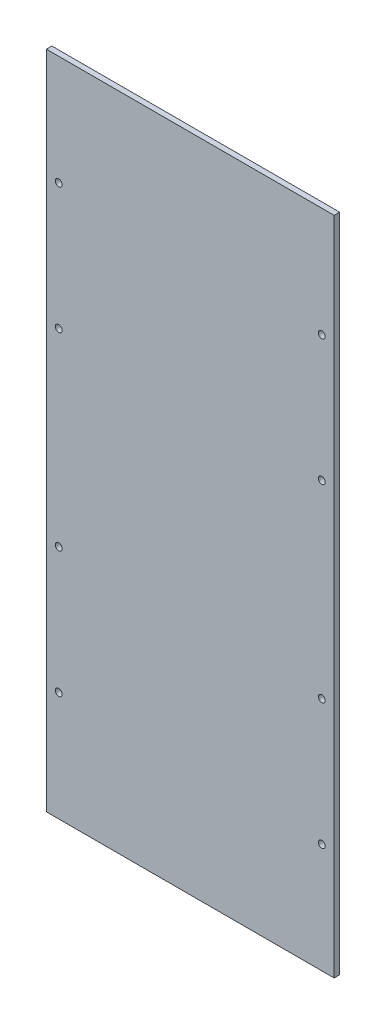
from build123d import *

# Parameters (mm, degrees)
CROQUIS1_W              = 210
CROQUIS1_H              = 482
CROQUIS1_R              = 2.5
SALIENTE_EXTRUIR1_DEPTH = 4


with BuildPart() as part:
    # Croquis1 → Saliente-Extruir1 (new body)
    with BuildSketch(Plane.XY):
        with Locations((14.498385096, 944.628389678)):
            Rectangle(CROQUIS1_W, CROQUIS1_H)
        with Locations((110.498385096, 1105.638389678)):
            Circle(CROQUIS1_R, mode=Mode.SUBTRACT)
        with Locations((-81.501614904, 1105.638389678)):
            Circle(CROQUIS1_R, mode=Mode.SUBTRACT)
        with Locations((-81.501614904, 1013.638389678)):
            Circle(CROQUIS1_R, mode=Mode.SUBTRACT)
        with Locations((110.498385096, 1013.638389678)):
            Circle(CROQUIS1_R, mode=Mode.SUBTRACT)
        with Locations((-81.501614904, 875.618389678)):
            Circle(CROQUIS1_R, mode=Mode.SUBTRACT)
        with Locations((110.498385096, 783.618389678)):
            Circle(CROQUIS1_R, mode=Mode.SUBTRACT)
        with Locations((-81.501614904, 783.618389678)):
            Circle(CROQUIS1_R, mode=Mode.SUBTRACT)
        with Locations((110.498385096, 875.618389678)):
            Circle(CROQUIS1_R, mode=Mode.SUBTRACT)
    extrude(amount=SALIENTE_EXTRUIR1_DEPTH)


solid = part.part
